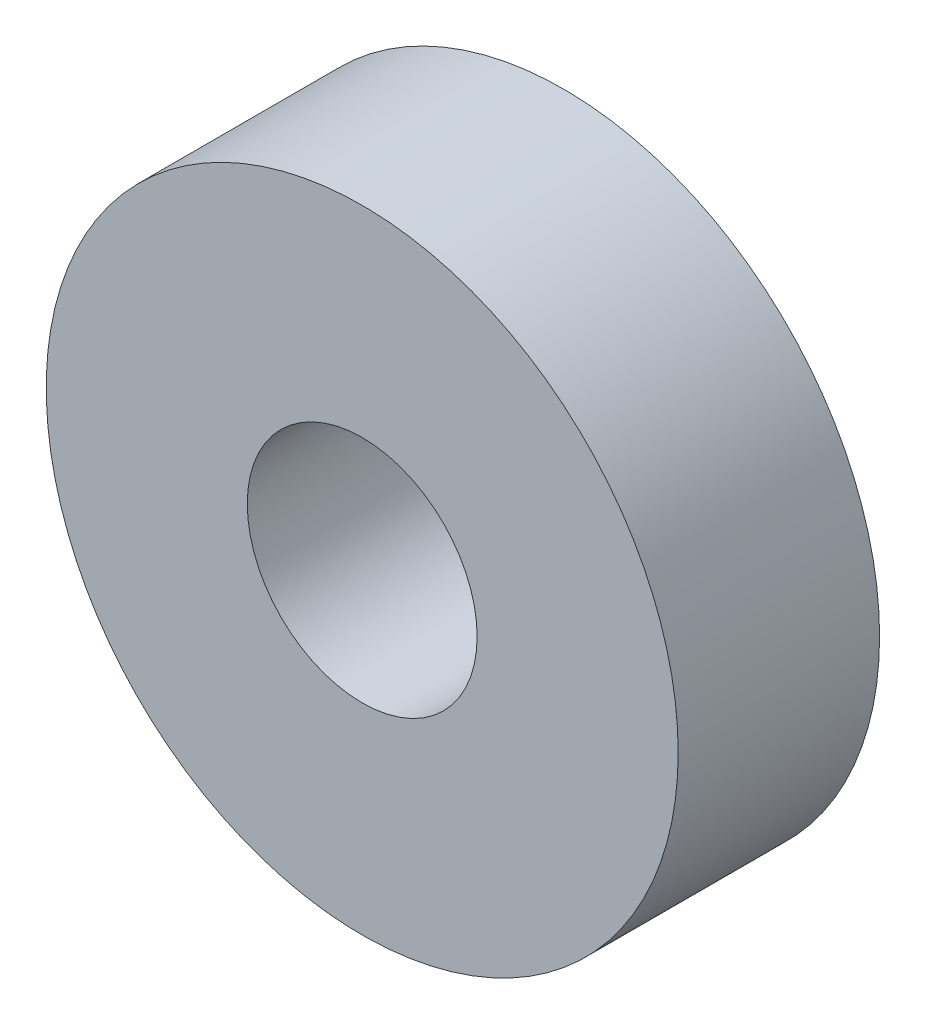
from build123d import *

# Parameters (mm, degrees)
SKETCH2_R           = 10.9982
BOSS_EXTRUDE1_DEPTH = 3.5052
SKETCH3_R           = 4.0005
CUT_EXTRUDE1_DEPTH  = 9.2202


with BuildPart() as part:
    # Sketch2 → Boss-Extrude1 (new, symmetric)
    with BuildSketch(Plane.XY):
        Circle(SKETCH2_R)
    extrude(amount=BOSS_EXTRUDE1_DEPTH, both=True)

    # Sketch3 → Cut-Extrude1 (cut, symmetric)
    with BuildSketch(Plane.XY):
        Circle(SKETCH3_R)
    extrude(amount=CUT_EXTRUDE1_DEPTH, both=True, mode=Mode.SUBTRACT)


solid = part.part
